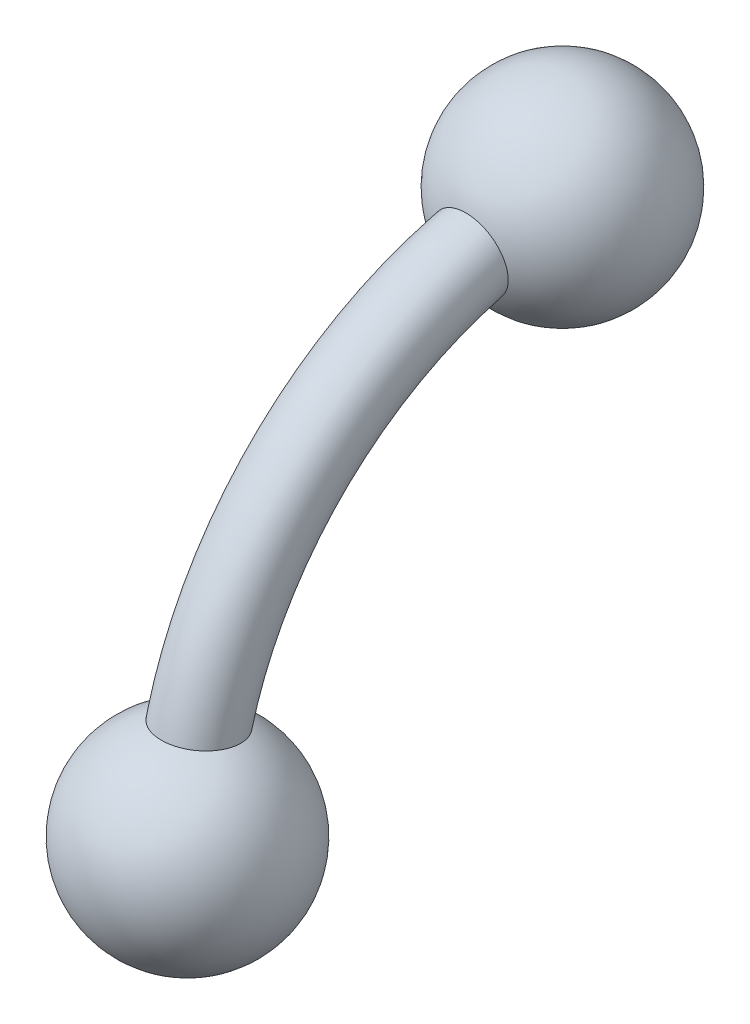
from build123d import *

# Parameters (mm, degrees)
ESQUISSE2_R             = 1.5
ESQUISSE2_R_2           = 1.25
R_VOLUTION2_ANGLE       = 90
ESQUISSE4_R             = 1.25
ENL_V_MAT_EXTRU_1_DEPTH = 10
ESQUISSE5_R             = 1.25
ENL_V_MAT_EXTRU_2_DEPTH = 10


with BuildPart() as part:
    # Esquisse1 → Révolution1 (revolve)
    with BuildSketch(Plane.XY):
        with BuildLine():
            Line((0, -4), (0, -3))
            ThreePointArc((0, -3), (-3, 0), (0, 3))
            Line((0, 3), (0, 4))
            ThreePointArc((0, 4), (-4, 0), (0, -4))
        make_face()
    revolve(axis=Axis((0, -4, 0), (0, 1, 0)))

    # Esquisse2 → Révolution2 (revolve)
    with BuildSketch(Plane(origin=(0, 0, 0), x_dir=(1, 0, 0), z_dir=(0, 1, 0))):
        Circle(ESQUISSE2_R)
        Circle(ESQUISSE2_R_2, mode=Mode.SUBTRACT)
    revolve(axis=Axis((-4.701525907, 0, -15), (-1, 0, 0)), revolution_arc=R_VOLUTION2_ANGLE)

    # Esquisse3 → Révolution3 (revolve)
    with BuildSketch(Plane(origin=(0, 0, 0), x_dir=(0, 0, -1), z_dir=(1, 0, 0))):
        with BuildLine():
            Line((15, 19), (15, 18))
            ThreePointArc((15, 18), (12, 15), (15, 12))
            Line((15, 12), (15, 11))
            ThreePointArc((15, 11), (11, 15), (15, 19))
        make_face()
    revolve(axis=Axis((0, 19, -15), (0, -1, 0)))

    # Esquisse4 → Enlèv. mat.-Extru.1 (cut)
    with BuildSketch(Plane(origin=(0, 0, 0), x_dir=(1, 0, 0), z_dir=(0, 1, 0))):
        with Locations(Location((0, 0, 0), (0, 0, 270))):
            Circle(ESQUISSE4_R)
    extrude(amount=-ENL_V_MAT_EXTRU_1_DEPTH, mode=Mode.SUBTRACT)

    # Esquisse5 → Enlèv. mat.-Extru.2 (cut)
    with BuildSketch(Plane.XY.offset(-15)):
        with Locations((0, 15)):
            Circle(ESQUISSE5_R)
    extrude(amount=-ENL_V_MAT_EXTRU_2_DEPTH, mode=Mode.SUBTRACT)


solid = part.part
